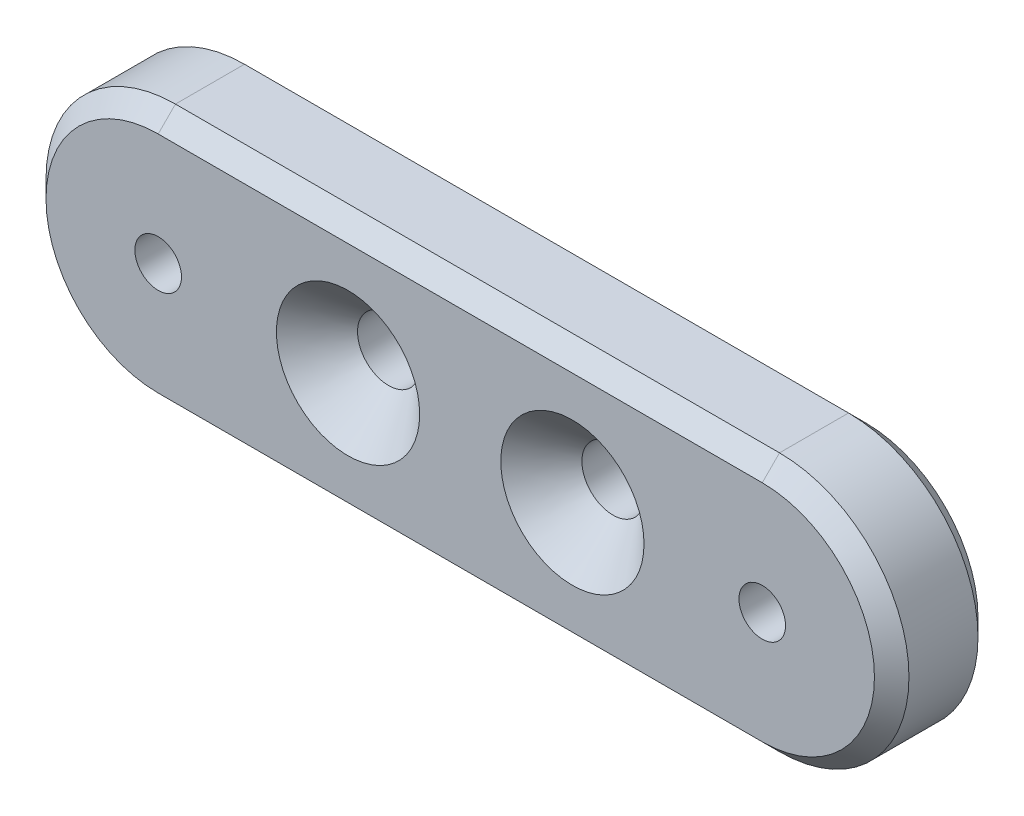
from build123d import *

# Parameters (mm, degrees)
SKETCH1_R                                    = 1.35
BOSS_EXTRUDE1_DEPTH                          = 6
CHAMFER1_SIZE                                = 1
CSK_FOR_M3_COUNTERSUNK_FLAT_HEAD_SCR_2_COUNT = 2
CSK_FOR_M3_COUNTERSUNK_FLAT_HEAD_SCR_2_PITCH = 13


with BuildPart() as part:
    # Sketch1 → Boss-Extrude1 (new body)
    with BuildSketch(Plane.XY):
        with BuildLine():
            Line((-17.5, 7.5), (17.5, 7.5))
            ThreePointArc((17.5, 7.5), (25, 0), (17.5, -7.5))
            Line((17.5, -7.5), (-17.5, -7.5))
            ThreePointArc((-17.5, -7.5), (-25, 0), (-17.5, 7.5))
        make_face()
        with Locations((-17.5, 0)):
            Circle(SKETCH1_R, mode=Mode.SUBTRACT)
        with Locations((17.5, 0)):
            Circle(SKETCH1_R, mode=Mode.SUBTRACT)
    extrude(amount=BOSS_EXTRUDE1_DEPTH)

    # Chamfer1
    chamfer1_edges = [part.edges().sort_by_distance(p)[0] for p in [
        (25, 0, 6),
        (0, 7.5, 6),
        (-25, 0, 6),
        (0, 7.5, 0),
        (25, 0, 0),
        (0, -7.5, 0),
        (-25, 0, 0),
        (0, -7.5, 6),
    ]]
    chamfer(chamfer1_edges, length=CHAMFER1_SIZE)

    # Sketch3 → CSK for M3 Countersunk Flat Head Screw1 (revolve, cut)
    with BuildSketch(Plane(origin=(6.5, 0, 6), x_dir=(0, -1, 0), z_dir=(1, 0, 0))):
        Polygon((0, 0), (0, 6), (1.825, 6), (1.8, 5.975), (1.8, 2.35), (4.15, 0), align=None)
    csk_for_m3_countersunk_flat_head_screw1 = revolve(axis=Axis((6.5, 0, 12.35), (0, 0, -1)), mode=Mode.SUBTRACT)

    # CSK for M3 Countersunk Flat Head Scr 2: CSK for M3 Countersunk Flat Head Screw1 ×2
    with Locations(*[(-i * CSK_FOR_M3_COUNTERSUNK_FLAT_HEAD_SCR_2_PITCH, 0, 0) for i in range(1, CSK_FOR_M3_COUNTERSUNK_FLAT_HEAD_SCR_2_COUNT)]):
        add(csk_for_m3_countersunk_flat_head_screw1, mode=Mode.SUBTRACT)


solid = part.part
